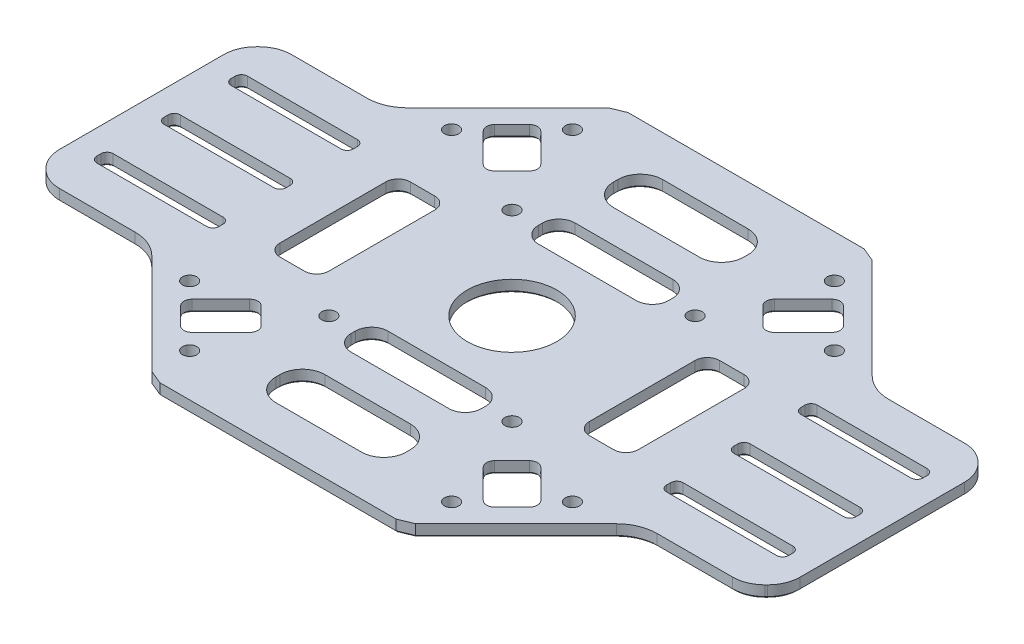
from build123d import *

# Parameters (mm, degrees)
SKETCH_1_R            = 11
EXTRUDE_1_DEPTH       = 3
SKETCH_2_R            = 1.75
CUT_EXTRUDE_1_DEPTH   = 10
CHAFL_N1_SIZE         = 0.5
CORTAR_EXTRUIR1_REACH = 148.571
CROQUIS1_R            = 1.75
CHAFL_N2_SIZE         = 0.5


with BuildPart() as part:
    # Эскиз1 → Бобышка-Вытянуть1 (new body)
    with BuildSketch(Plane(origin=(0, 0, 0), x_dir=(1, 0, 0), z_dir=(0, 1, 0))):
        with BuildLine():
            Line((-47.211769871, -20.186291501), (-47.211769871, 20.186291501))
            ThreePointArc((-47.211769871, 20.186291501), (-46.602806131, 23.24775896), (-44.86862412, 25.843145751))
            Line((-44.86862412, 25.843145751), (-44.554915621, 26.156854249))
            ThreePointArc((-44.554915621, 26.156854249), (-41.95952883, 27.89103626), (-38.898061372, 28.5))
            Line((-38.898061372, 28.5), (-20.353905494, 28.5))
            ThreePointArc((-20.353905494, 28.5), (-16.527071171, 29.261204675), (-13.282837682, 31.428932188))
            Line((-13.282837682, 31.428932188), (11.374016567, 56.085786438))
            Line((11.374016567, 56.085786438), (14.788230129, 57.5))
            Line((14.788230129, 57.5), (15.788230129, 57.5))
            Line((15.788230129, 57.5), (71.788230129, 57.5))
            Line((71.788230129, 57.5), (72.788230129, 57.5))
            Line((72.788230129, 57.5), (76.202443692, 56.085786438))
            Line((76.202443692, 56.085786438), (100.859297941, 31.428932188))
            ThreePointArc((100.859297941, 31.428932188), (104.10353143, 29.261204675), (107.930365753, 28.5))
            Line((107.930365753, 28.5), (126.47452163, 28.5))
            ThreePointArc((126.47452163, 28.5), (129.535989089, 27.89103626), (132.13137588, 26.156854249))
            Line((132.13137588, 26.156854249), (132.445084379, 25.843145751))
            ThreePointArc((132.445084379, 25.843145751), (134.17926639, 23.24775896), (134.788230129, 20.186291501))
            Line((134.788230129, 20.186291501), (134.788230129, -20.186291501))
            ThreePointArc((134.788230129, -20.186291501), (134.17926639, -23.24775896), (132.445084379, -25.843145751))
            Line((132.445084379, -25.843145751), (132.13137588, -26.156854249))
            ThreePointArc((132.13137588, -26.156854249), (129.535989089, -27.89103626), (126.47452163, -28.5))
            Line((126.47452163, -28.5), (107.930365753, -28.5))
            ThreePointArc((107.930365753, -28.5), (104.10353143, -29.261204675), (100.859297941, -31.428932188))
            Line((100.859297941, -31.428932188), (76.202443692, -56.085786438))
            Line((76.202443692, -56.085786438), (72.788230129, -57.5))
            Line((72.788230129, -57.5), (71.788230129, -57.5))
            Line((71.788230129, -57.5), (15.788230129, -57.5))
            Line((15.788230129, -57.5), (14.788230129, -57.5))
            Line((14.788230129, -57.5), (11.374016567, -56.085786438))
            Line((11.374016567, -56.085786438), (-13.282837682, -31.428932188))
            ThreePointArc((-13.282837682, -31.428932188), (-16.527071171, -29.261204675), (-20.353905494, -28.5))
            Line((-20.353905494, -28.5), (-38.898061372, -28.5))
            ThreePointArc((-38.898061372, -28.5), (-41.95952883, -27.89103626), (-44.554915621, -26.156854249))
            Line((-44.554915621, -26.156854249), (-44.86862412, -25.843145751))
            ThreePointArc((-44.86862412, -25.843145751), (-46.602806131, -23.24775896), (-47.211769871, -20.186291501))
        make_face()
        with Locations(Location((43.788230129, 0, 0), (0, 0, 270))):
            Circle(SKETCH_1_R, mode=Mode.SUBTRACT)
        with BuildLine():
            Line((59.788230129, 23.5), (59.788230129, 22.5))
            ThreePointArc((59.788230129, 22.5), (58.616657254, 19.671572875), (55.788230129, 18.5))
            Line((55.788230129, 18.5), (31.788230129, 18.5))
            ThreePointArc((31.788230129, 18.5), (28.959803005, 19.671572875), (27.788230129, 22.5))
            Line((27.788230129, 22.5), (27.788230129, 23.5))
            ThreePointArc((27.788230129, 23.5), (28.959803005, 26.328427125), (31.788230129, 27.5))
            Line((31.788230129, 27.5), (55.788230129, 27.5))
            ThreePointArc((55.788230129, 27.5), (58.616657254, 26.328427125), (59.788230129, 23.5))
        make_face(mode=Mode.SUBTRACT)
        with BuildLine():
            Line((72.482541852, 32.935630592), (76.725182539, 28.692989905))
            ThreePointArc((76.725182539, 28.692989905), (78.139396102, 28.107203467), (79.553609664, 28.692989905))
            Line((79.553609664, 28.692989905), (86.624677476, 35.764057717))
            ThreePointArc((86.624677476, 35.764057717), (87.210463913, 37.178271279), (86.624677476, 38.592484842))
            Line((86.624677476, 38.592484842), (84.503357132, 40.713805185))
            Line((84.503357132, 40.713805185), (82.382036789, 42.835125529))
            ThreePointArc((82.382036789, 42.835125529), (80.967823226, 43.420911966), (79.553609664, 42.835125529))
            Line((79.553609664, 42.835125529), (72.482541852, 35.764057717))
            ThreePointArc((72.482541852, 35.764057717), (71.896755414, 34.349844155), (72.482541852, 32.935630592))
        make_face(mode=Mode.SUBTRACT)
        with BuildLine():
            Line((59.788230129, 42), (59.788230129, 41))
            ThreePointArc((59.788230129, 41), (58.177317426, 37.110912703), (54.288230129, 35.5))
            Line((54.288230129, 35.5), (33.288230129, 35.5))
            ThreePointArc((33.288230129, 35.5), (29.399142833, 37.110912703), (27.788230129, 41))
            Line((27.788230129, 41), (27.788230129, 42))
            ThreePointArc((27.788230129, 42), (29.399142833, 45.889087297), (33.288230129, 47.5))
            Line((33.288230129, 47.5), (54.288230129, 47.5))
            ThreePointArc((54.288230129, 47.5), (58.177317426, 45.889087297), (59.788230129, 42))
        make_face(mode=Mode.SUBTRACT)
        with BuildLine():
            Line((75.788230129, -13), (75.788230129, 13))
            ThreePointArc((75.788230129, 13), (76.666909786, 15.121320344), (78.788230129, 16))
            Line((78.788230129, 16), (84.788230129, 16))
            ThreePointArc((84.788230129, 16), (86.909550473, 15.121320344), (87.788230129, 13))
            Line((87.788230129, 13), (87.788230129, -13))
            ThreePointArc((87.788230129, -13), (86.909550473, -15.121320344), (84.788230129, -16))
            Line((84.788230129, -16), (78.788230129, -16))
            ThreePointArc((78.788230129, -16), (76.666909786, -15.121320344), (75.788230129, -13))
        make_face(mode=Mode.SUBTRACT)
        with BuildLine():
            Line((-39.711769871, 2), (-12.711769871, 2))
            ThreePointArc((-12.711769871, 2), (-11.651109699, 1.560660172), (-11.211769871, 0.5))
            Line((-11.211769871, 0.5), (-11.211769871, -0.5))
            ThreePointArc((-11.211769871, -0.5), (-11.651109699, -1.560660172), (-12.711769871, -2))
            Line((-12.711769871, -2), (-39.711769871, -2))
            ThreePointArc((-39.711769871, -2), (-40.772430042, -1.560660172), (-41.211769871, -0.5))
            Line((-41.211769871, -0.5), (-41.211769871, 0.5))
            ThreePointArc((-41.211769871, 0.5), (-40.772430042, 1.560660172), (-39.711769871, 2))
        make_face(mode=Mode.SUBTRACT)
        with BuildLine():
            Line((100.288230129, 18.5), (127.288230129, 18.5))
            ThreePointArc((127.288230129, 18.5), (128.348890301, 18.060660172), (128.788230129, 17))
            Line((128.788230129, 17), (128.788230129, 16))
            ThreePointArc((128.788230129, 16), (128.348890301, 14.939339828), (127.288230129, 14.5))
            Line((127.288230129, 14.5), (100.288230129, 14.5))
            ThreePointArc((100.288230129, 14.5), (99.227569958, 14.939339828), (98.788230129, 16))
            Line((98.788230129, 16), (98.788230129, 17))
            ThreePointArc((98.788230129, 17), (99.227569958, 18.060660172), (100.288230129, 18.5))
        make_face(mode=Mode.SUBTRACT)
        with BuildLine():
            Line((98.788230129, 0.5), (98.788230129, -0.5))
            ThreePointArc((98.788230129, -0.5), (99.227569958, -1.560660172), (100.288230129, -2))
            Line((100.288230129, -2), (127.288230129, -2))
            ThreePointArc((127.288230129, -2), (128.348890301, -1.560660172), (128.788230129, -0.5))
            Line((128.788230129, -0.5), (128.788230129, 0.5))
            ThreePointArc((128.788230129, 0.5), (128.348890301, 1.560660172), (127.288230129, 2))
            Line((127.288230129, 2), (100.288230129, 2))
            ThreePointArc((100.288230129, 2), (99.227569958, 1.560660172), (98.788230129, 0.5))
        make_face(mode=Mode.SUBTRACT)
        with BuildLine():
            Line((31.788230129, -18.5), (55.788230129, -18.5))
            ThreePointArc((55.788230129, -18.5), (58.616657254, -19.671572875), (59.788230129, -22.5))
            Line((59.788230129, -22.5), (59.788230129, -23.5))
            ThreePointArc((59.788230129, -23.5), (58.616657254, -26.328427125), (55.788230129, -27.5))
            Line((55.788230129, -27.5), (31.788230129, -27.5))
            ThreePointArc((31.788230129, -27.5), (28.959803005, -26.328427125), (27.788230129, -23.5))
            Line((27.788230129, -23.5), (27.788230129, -22.5))
            ThreePointArc((27.788230129, -22.5), (28.959803005, -19.671572875), (31.788230129, -18.5))
        make_face(mode=Mode.SUBTRACT)
        with BuildLine():
            Line((15.093918407, -32.935630592), (10.85127772, -28.692989905))
            ThreePointArc((10.85127772, -28.692989905), (9.437064157, -28.107203467), (8.022850595, -28.692989905))
            Line((8.022850595, -28.692989905), (0.951782783, -35.764057717))
            ThreePointArc((0.951782783, -35.764057717), (0.365996345, -37.178271279), (0.951782783, -38.592484842))
            Line((0.951782783, -38.592484842), (3.073103127, -40.713805185))
            Line((3.073103127, -40.713805185), (5.19442347, -42.835125529))
            ThreePointArc((5.19442347, -42.835125529), (6.608637033, -43.420911966), (8.022850595, -42.835125529))
            Line((8.022850595, -42.835125529), (15.093918407, -35.764057717))
            ThreePointArc((15.093918407, -35.764057717), (15.679704844, -34.349844155), (15.093918407, -32.935630592))
        make_face(mode=Mode.SUBTRACT)
        with BuildLine():
            Line((33.288230129, -35.5), (54.288230129, -35.5))
            ThreePointArc((54.288230129, -35.5), (58.177317426, -37.110912703), (59.788230129, -41))
            Line((59.788230129, -41), (59.788230129, -42))
            ThreePointArc((59.788230129, -42), (58.177317426, -45.889087297), (54.288230129, -47.5))
            Line((54.288230129, -47.5), (33.288230129, -47.5))
            ThreePointArc((33.288230129, -47.5), (29.399142833, -45.889087297), (27.788230129, -42))
            Line((27.788230129, -42), (27.788230129, -41))
            ThreePointArc((27.788230129, -41), (29.399142833, -37.110912703), (33.288230129, -35.5))
        make_face(mode=Mode.SUBTRACT)
        with BuildLine():
            Line((-11.211769871, 16), (-11.211769871, 17))
            ThreePointArc((-11.211769871, 17), (-11.651109699, 18.060660172), (-12.711769871, 18.5))
            Line((-12.711769871, 18.5), (-39.711769871, 18.5))
            ThreePointArc((-39.711769871, 18.5), (-40.772430042, 18.060660172), (-41.211769871, 17))
            Line((-41.211769871, 17), (-41.211769871, 16))
            ThreePointArc((-41.211769871, 16), (-40.772430042, 14.939339828), (-39.711769871, 14.5))
            Line((-39.711769871, 14.5), (-12.711769871, 14.5))
            ThreePointArc((-12.711769871, 14.5), (-11.651109699, 14.939339828), (-11.211769871, 16))
        make_face(mode=Mode.SUBTRACT)
        with BuildLine():
            Line((2.788230129, -16), (8.788230129, -16))
            ThreePointArc((8.788230129, -16), (10.909550473, -15.121320344), (11.788230129, -13))
            Line((11.788230129, -13), (11.788230129, 13))
            ThreePointArc((11.788230129, 13), (10.909550473, 15.121320344), (8.788230129, 16))
            Line((8.788230129, 16), (2.788230129, 16))
            ThreePointArc((2.788230129, 16), (0.666909786, 15.121320344), (-0.211769871, 13))
            Line((-0.211769871, 13), (-0.211769871, -13))
            ThreePointArc((-0.211769871, -13), (0.666909786, -15.121320344), (2.788230129, -16))
        make_face(mode=Mode.SUBTRACT)
        with BuildLine():
            Line((-12.711769871, -18.5), (-39.711769871, -18.5))
            ThreePointArc((-39.711769871, -18.5), (-40.772430042, -18.060660172), (-41.211769871, -17))
            Line((-41.211769871, -17), (-41.211769871, -16))
            ThreePointArc((-41.211769871, -16), (-40.772430042, -14.939339828), (-39.711769871, -14.5))
            Line((-39.711769871, -14.5), (-12.711769871, -14.5))
            ThreePointArc((-12.711769871, -14.5), (-11.651109699, -14.939339828), (-11.211769871, -16))
            Line((-11.211769871, -16), (-11.211769871, -17))
            ThreePointArc((-11.211769871, -17), (-11.651109699, -18.060660172), (-12.711769871, -18.5))
        make_face(mode=Mode.SUBTRACT)
        with BuildLine():
            Line((98.788230129, -16), (98.788230129, -17))
            ThreePointArc((98.788230129, -17), (99.227569958, -18.060660172), (100.288230129, -18.5))
            Line((100.288230129, -18.5), (127.288230129, -18.5))
            ThreePointArc((127.288230129, -18.5), (128.348890301, -18.060660172), (128.788230129, -17))
            Line((128.788230129, -17), (128.788230129, -16))
            ThreePointArc((128.788230129, -16), (128.348890301, -14.939339828), (127.288230129, -14.5))
            Line((127.288230129, -14.5), (100.288230129, -14.5))
            ThreePointArc((100.288230129, -14.5), (99.227569958, -14.939339828), (98.788230129, -16))
        make_face(mode=Mode.SUBTRACT)
        with BuildLine():
            Line((3.073103127, 40.713805185), (5.19442347, 42.835125529))
            ThreePointArc((5.19442347, 42.835125529), (6.608637033, 43.420911966), (8.022850595, 42.835125529))
            Line((8.022850595, 42.835125529), (15.093918407, 35.764057717))
            ThreePointArc((15.093918407, 35.764057717), (15.679704844, 34.349844155), (15.093918407, 32.935630592))
            Line((15.093918407, 32.935630592), (10.85127772, 28.692989905))
            ThreePointArc((10.85127772, 28.692989905), (9.437064157, 28.107203467), (8.022850595, 28.692989905))
            Line((8.022850595, 28.692989905), (0.951782783, 35.764057717))
            ThreePointArc((0.951782783, 35.764057717), (0.365996345, 37.178271279), (0.951782783, 38.592484842))
            Line((0.951782783, 38.592484842), (3.073103127, 40.713805185))
        make_face(mode=Mode.SUBTRACT)
        with BuildLine():
            Line((84.503357132, -40.713805185), (82.382036789, -42.835125529))
            ThreePointArc((82.382036789, -42.835125529), (80.967823226, -43.420911966), (79.553609664, -42.835125529))
            Line((79.553609664, -42.835125529), (72.482541852, -35.764057717))
            ThreePointArc((72.482541852, -35.764057717), (71.896755414, -34.349844155), (72.482541852, -32.935630592))
            Line((72.482541852, -32.935630592), (76.725182539, -28.692989905))
            ThreePointArc((76.725182539, -28.692989905), (78.139396102, -28.107203467), (79.553609664, -28.692989905))
            Line((79.553609664, -28.692989905), (86.624677476, -35.764057717))
            ThreePointArc((86.624677476, -35.764057717), (87.210463913, -37.178271279), (86.624677476, -38.592484842))
            Line((86.624677476, -38.592484842), (84.503357132, -40.713805185))
        make_face(mode=Mode.SUBTRACT)
    extrude(amount=EXTRUDE_1_DEPTH)

    # Эскиз2 → Вырез-Вытянуть1 (cut)
    with BuildSketch(Plane(origin=(0, 3, 0), x_dir=(1, 0, 0), z_dir=(0, 1, 0))):
        with Locations(Location((11.614870129, 47.022602405, 0), (0, 0, 270))):
            Circle(SKETCH_2_R)
        with Locations(Location((-3.234372275, 32.17336, 0), (0, 0, 270))):
            Circle(SKETCH_2_R)
        with Locations(Location((75.961590129, 47.022602405, 0), (0, 0, 270))):
            Circle(SKETCH_2_R)
        with Locations(Location((90.810832534, 32.17336, 0), (0, 0, 270))):
            Circle(SKETCH_2_R)
        with Locations(Location((90.810832534, -32.17336, 0), (0, 0, 270))):
            Circle(SKETCH_2_R)
        with Locations(Location((75.961590129, -47.022602405, 0), (0, 0, 270))):
            Circle(SKETCH_2_R)
        with Locations(Location((11.614870129, -47.022602405, 0), (0, 0, 270))):
            Circle(SKETCH_2_R)
        with Locations(Location((-3.234372275, -32.17336, 0), (0, 0, 270))):
            Circle(SKETCH_2_R)
    extrude(amount=-CUT_EXTRUDE_1_DEPTH, mode=Mode.SUBTRACT)

    # Chaflán1
    chafl_n1_edges = [part.edges().sort_by_distance(p)[0] for p in [
        (-11.651109699, 0, -1.560660172),
        (-26.211769871, 0, -2),
        (-40.772430042, 0, -1.560660172),
        (-41.211769871, 0, 0),
        (-40.772430042, 0, 1.560660172),
        (-26.211769871, 0, 2),
        (-11.651109699, 0, 1.560660172),
        (-11.211769871, 0, 0),
        (58.616657254, 0, -26.328427125),
        (43.788230129, 0, -27.5),
        (28.959803005, 0, -26.328427125),
        (27.788230129, 0, -23),
        (28.959803005, 0, -19.671572875),
        (43.788230129, 0, -18.5),
        (58.616657254, 0, -19.671572875),
        (59.788230129, 0, -23),
        (86.909550473, 0, -15.121320344),
        (81.788230129, 0, -16),
        (76.666909786, 0, -15.121320344),
        (75.788230129, 0, 0),
        (76.666909786, 0, 15.121320344),
        (81.788230129, 0, 16),
        (86.909550473, 0, 15.121320344),
        (87.788230129, 0, 0),
        (80.967823226, 0, -43.420911966),
        (76.018075758, 0, -39.299591623),
        (71.896755414, 0, -34.349844155),
        (74.603862196, 0, -30.814310249),
        (78.139396102, 0, -28.107203467),
        (83.08914357, 0, -32.228523811),
        (87.210463913, 0, -37.178271279),
        (84.503357132, 0, -40.713805185),
        (99.227569958, 0, -18.060660172),
        (98.788230129, 0, -16.5),
        (99.227569958, 0, -14.939339828),
        (113.788230129, 0, -14.5),
        (128.348890301, 0, -14.939339828),
        (128.788230129, 0, -16.5),
        (128.348890301, 0, -18.060660172),
        (113.788230129, 0, -18.5),
        (87.210463913, 0, 37.178271279),
        (83.08914357, 0, 32.228523811),
        (78.139396102, 0, 28.107203467),
        (74.603862196, 0, 30.814310249),
        (71.896755414, 0, 34.349844155),
        (76.018075758, 0, 39.299591623),
        (80.967823226, 0, 43.420911966),
        (84.503357132, 0, 40.713805185),
        (0.365996345, 0, -37.178271279),
        (4.487316689, 0, -32.228523811),
        (9.437064157, 0, -28.107203467),
        (12.972598063, 0, -30.814310249),
        (15.679704844, 0, -34.349844155),
        (11.558384501, 0, -39.299591623),
        (6.608637033, 0, -43.420911966),
        (3.073103127, 0, -40.713805185),
        (128.348890301, 0, -1.560660172),
        (113.788230129, 0, -2),
        (99.227569958, 0, -1.560660172),
        (98.788230129, 0, 0),
        (99.227569958, 0, 1.560660172),
        (113.788230129, 0, 2),
        (128.348890301, 0, 1.560660172),
        (128.788230129, 0, 0),
        (-44.711769871, 0, -26),
        (-41.95952883, 0, -27.89103626),
        (29.399142833, 0, 45.889087297),
        (43.788230129, 0, 47.5),
        (58.177317426, 0, 45.889087297),
        (59.788230129, 0, 41.5),
        (58.177317426, 0, 37.110912703),
        (43.788230129, 0, 35.5),
        (-29.625983433, 0, -28.5),
        (29.399142833, 0, 37.110912703),
        (27.788230129, 0, 41.5),
        (-16.527071171, 0, -29.261204675),
        (-0.954410558, 0, -43.757359313),
        (13.081123348, 0, -56.792893219),
        (43.788230129, 0, -57.5),
        (28.959803005, 0, 26.328427125),
        (43.788230129, 0, 27.5),
        (58.616657254, 0, 26.328427125),
        (59.788230129, 0, 23),
        (58.616657254, 0, 19.671572875),
        (43.788230129, 0, 18.5),
        (28.959803005, 0, 19.671572875),
        (27.788230129, 0, 23),
        (74.495336911, 0, -56.792893219),
        (88.530870817, 0, -43.757359313),
        (104.10353143, 0, -29.261204675),
        (117.202443692, 0, -28.5),
        (129.535989089, 0, -27.89103626),
        (-40.772430042, 0, -18.060660172),
        (-41.211769871, 0, -16.5),
        (-40.772430042, 0, -14.939339828),
        (-26.211769871, 0, -14.5),
        (-11.651109699, 0, -14.939339828),
        (-11.211769871, 0, -16.5),
        (-11.651109699, 0, -18.060660172),
        (132.288230129, 0, -26),
        (-26.211769871, 0, -18.5),
        (134.17926639, 0, -23.24775896),
        (134.788230129, 0, 0),
        (134.17926639, 0, 23.24775896),
        (132.288230129, 0, 26),
        (129.535989089, 0, 27.89103626),
        (0.666909786, 0, 15.121320344),
        (5.788230129, 0, 16),
        (10.909550473, 0, 15.121320344),
        (11.788230129, 0, 0),
        (10.909550473, 0, -15.121320344),
        (5.788230129, 0, -16),
        (0.666909786, 0, -15.121320344),
        (-0.211769871, 0, 0),
        (117.202443692, 0, 28.5),
        (104.10353143, 0, 29.261204675),
        (88.530870817, 0, 43.757359313),
        (74.495336911, 0, 56.792893219),
        (43.788230129, 0, 57.5),
        (6.608637033, 0, 43.420911966),
        (11.558384501, 0, 39.299591623),
        (15.679704844, 0, 34.349844155),
        (12.972598063, 0, 30.814310249),
        (9.437064157, 0, 28.107203467),
        (4.487316689, 0, 32.228523811),
        (0.365996345, 0, 37.178271279),
        (3.073103127, 0, 40.713805185),
        (13.081123348, 0, 56.792893219),
        (-0.954410558, 0, 43.757359313),
        (-16.527071171, 0, 29.261204675),
        (-29.625983433, 0, 28.5),
        (-41.95952883, 0, 27.89103626),
        (128.348890301, 0, 18.060660172),
        (128.788230129, 0, 16.5),
        (128.348890301, 0, 14.939339828),
        (113.788230129, 0, 14.5),
        (99.227569958, 0, 14.939339828),
        (98.788230129, 0, 16.5),
        (99.227569958, 0, 18.060660172),
        (-44.711769871, 0, 26),
        (113.788230129, 0, 18.5),
        (-46.602806131, 0, 23.24775896),
        (-47.211769871, 0, 0),
        (-46.602806131, 0, -23.24775896),
        (-11.651109699, 0, 18.060660172),
        (-11.211769871, 0, 16.5),
        (-11.651109699, 0, 14.939339828),
        (-26.211769871, 0, 14.5),
        (-40.772430042, 0, 14.939339828),
        (-41.211769871, 0, 16.5),
        (-40.772430042, 0, 18.060660172),
        (-26.211769871, 0, 18.5),
        (43.788230129, 0, -11),
        (11.614870129, 0, -48.772602405),
        (-3.234372275, 0, -33.92336),
        (75.961590129, 0, -48.772602405),
        (90.810832534, 0, -33.92336),
        (90.810832534, 0, 30.42336),
        (75.961590129, 0, 45.272602405),
        (11.614870129, 0, 45.272602405),
        (-3.234372275, 0, 30.42336),
        (58.177317426, 0, -45.889087297),
        (43.788230129, 0, -47.5),
        (29.399142833, 0, -45.889087297),
        (27.788230129, 0, -41.5),
        (29.399142833, 0, -37.110912703),
        (43.788230129, 0, -35.5),
        (58.177317426, 0, -37.110912703),
        (59.788230129, 0, -41.5),
    ]]
    chamfer(chafl_n1_edges, length=CHAFL_N1_SIZE)

    # Croquis1 → Cortar-Extruir1 (cut, up to next)
    with BuildSketch(Plane(origin=(0, 3, 0), x_dir=(1, 0, 0), z_dir=(0, 1, 0)), mode=Mode.PRIVATE) as cortar_extruir1_sk1:
        with Locations(Location((21.288230129, 22.5, 0), (0, 0, 270))):
            Circle(CROQUIS1_R)
    cortar_extruir1_tool1 = extrude(cortar_extruir1_sk1.sketch, amount=-CORTAR_EXTRUIR1_REACH, mode=Mode.PRIVATE) & part.part
    # Croquis1 → Cortar-Extruir1 (cut, up to next)
    with BuildSketch(Plane(origin=(0, 3, 0), x_dir=(1, 0, 0), z_dir=(0, 1, 0)), mode=Mode.PRIVATE) as cortar_extruir1_sk2:
        with Locations(Location((66.288230129, 22.5, 0), (0, 0, 270))):
            Circle(CROQUIS1_R)
    cortar_extruir1_tool2 = extrude(cortar_extruir1_sk2.sketch, amount=-CORTAR_EXTRUIR1_REACH, mode=Mode.PRIVATE) & part.part
    # Croquis1 → Cortar-Extruir1 (cut, up to next)
    with BuildSketch(Plane(origin=(0, 3, 0), x_dir=(1, 0, 0), z_dir=(0, 1, 0)), mode=Mode.PRIVATE) as cortar_extruir1_sk3:
        with Locations(Location((66.288230129, -22.5, 0), (0, 0, 270))):
            Circle(CROQUIS1_R)
    cortar_extruir1_tool3 = extrude(cortar_extruir1_sk3.sketch, amount=-CORTAR_EXTRUIR1_REACH, mode=Mode.PRIVATE) & part.part
    # Croquis1 → Cortar-Extruir1 (cut, up to next)
    with BuildSketch(Plane(origin=(0, 3, 0), x_dir=(1, 0, 0), z_dir=(0, 1, 0)), mode=Mode.PRIVATE) as cortar_extruir1_sk4:
        with Locations(Location((21.288230129, -22.5, 0), (0, 0, 270))):
            Circle(CROQUIS1_R)
    cortar_extruir1_tool4 = extrude(cortar_extruir1_sk4.sketch, amount=-CORTAR_EXTRUIR1_REACH, mode=Mode.PRIVATE) & part.part
    add(cortar_extruir1_tool1.solids().sort_by_distance((21.28823, 3, -22.5))[0], mode=Mode.SUBTRACT)
    add(cortar_extruir1_tool2.solids().sort_by_distance((66.28823, 3, -22.5))[0], mode=Mode.SUBTRACT)
    add(cortar_extruir1_tool3.solids().sort_by_distance((66.28823, 3, 22.5))[0], mode=Mode.SUBTRACT)
    add(cortar_extruir1_tool4.solids().sort_by_distance((21.28823, 3, 22.5))[0], mode=Mode.SUBTRACT)

    # Chaflán2
    chafl_n2_edges = [part.edges().sort_by_distance(p)[0] for p in [
        (21.288230129, 0, -24.25),
        (66.288230129, 0, -24.25),
        (66.288230129, 0, 20.75),
        (21.288230129, 0, 20.75),
    ]]
    chamfer(chafl_n2_edges, length=CHAFL_N2_SIZE)


solid = part.part
